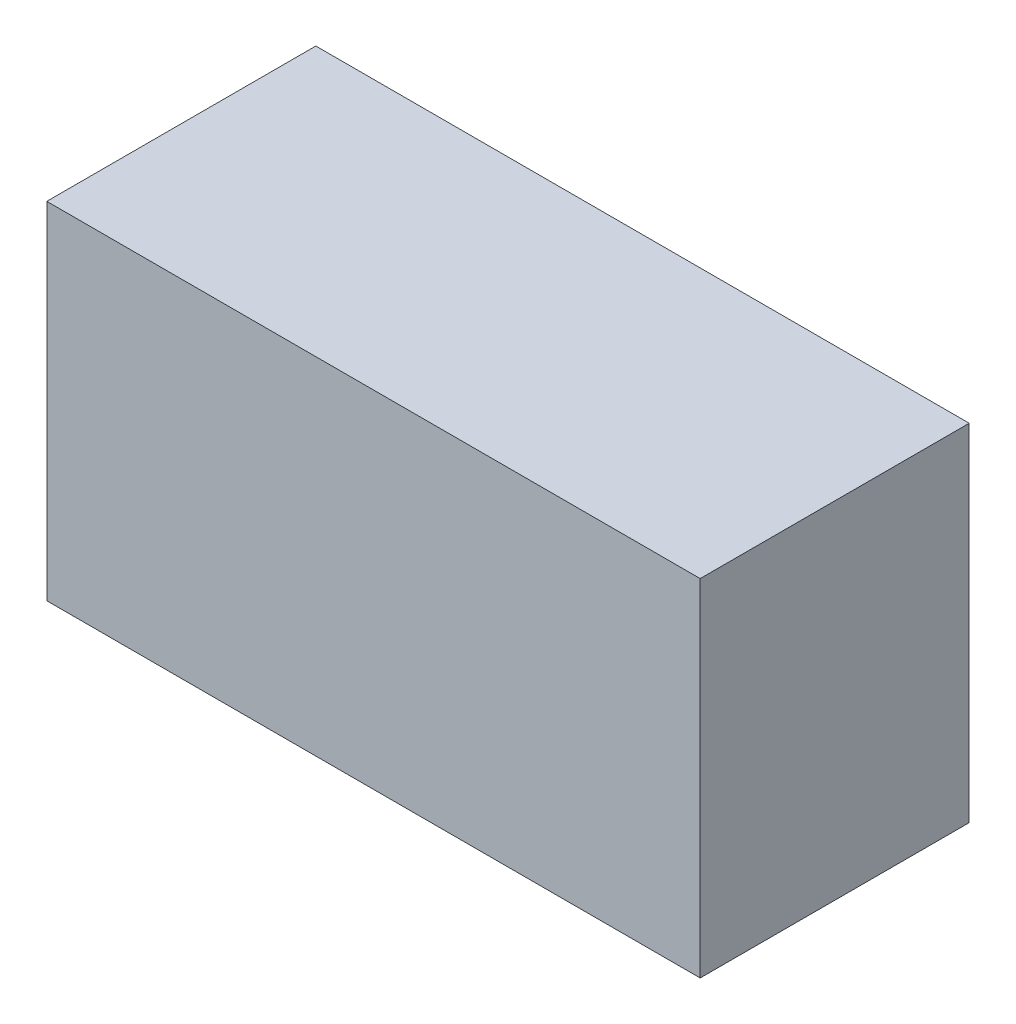
from build123d import *

# Parameters (mm, degrees)
SKETCH_1_W      = 85
SKETCH_1_H      = 45
EXTRUDE_1_DEPTH = 35


with BuildPart() as part:
    # 草图1 → 凸台-拉伸1 (new body)
    with BuildSketch(Plane.XY):
        Rectangle(SKETCH_1_W, SKETCH_1_H)
    extrude(amount=EXTRUDE_1_DEPTH)


solid = part.part
